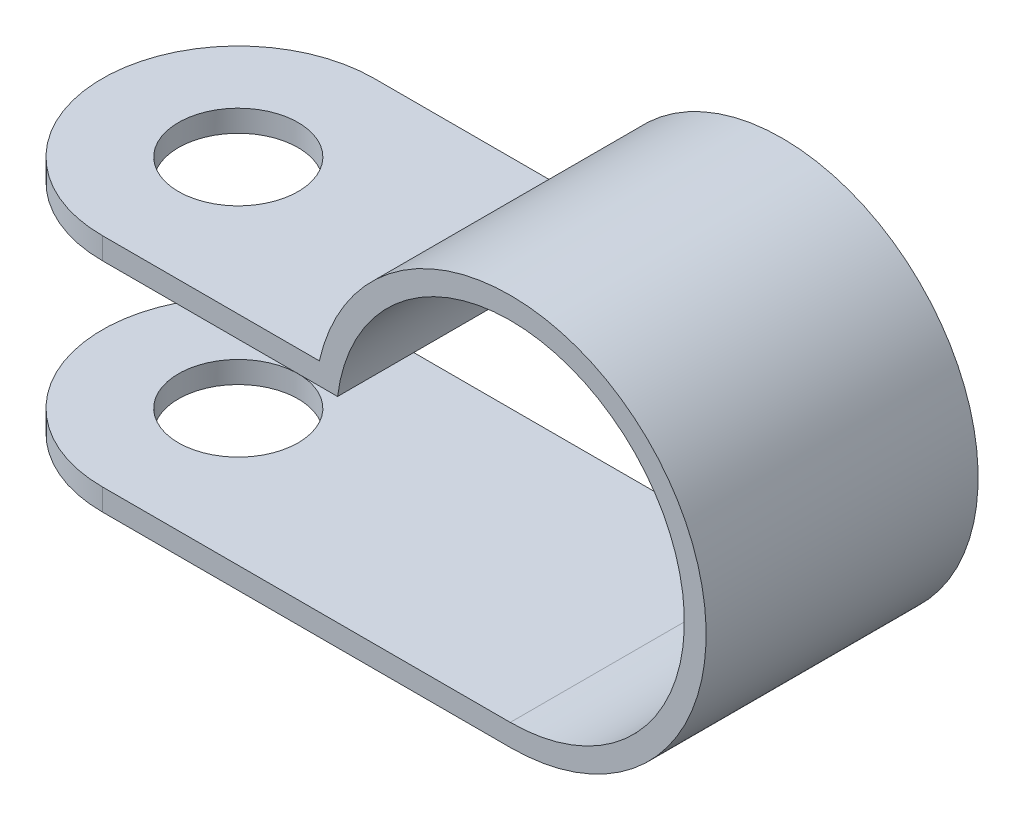
from build123d import *

# Parameters (mm, degrees)
BOSS_EXTRUDE1_DEPTH = 9.525
SKETCH2_R           = 2.0955
CUT_EXTRUDE1_DEPTH  = 29.848015755


with BuildPart() as part:
    # Sketch1 → Boss-Extrude1 (new body)
    with BuildSketch(Plane.XY):
        with BuildLine():
            Line((0, 8.382), (12.363477137, 8.382))
            ThreePointArc((12.363477137, 8.382), (24.411145213, 11.134714393), (19.05, 0))
            Line((19.05, 0), (0, 0))
            Line((0, 0), (0, 0.762))
            Line((0, 0.762), (19.05, 0.762))
            ThreePointArc((19.05, 0.762), (23.622, 10.890124998), (13.001812503, 7.62))
            Line((13.001812503, 7.62), (0, 7.62))
            Line((0, 7.62), (0, 8.382))
        make_face()
    extrude(amount=BOSS_EXTRUDE1_DEPTH)

    # Sketch2 → Cut-Extrude1 (cut, through all)
    with BuildSketch(Plane(origin=(0, 8.382, 0), x_dir=(1, 0, 0), z_dir=(0, 1, 0))):
        with BuildLine():
            Line((0, 0), (0, -4.7625))
            ThreePointArc((0, -4.7625), (1.394903955, -1.394903955), (4.7625, 0))
            Line((4.7625, 0), (0, 0))
        make_face()
        with BuildLine():
            Line((0, -9.525), (4.7625, -9.525))
            ThreePointArc((4.7625, -9.525), (1.394903955, -8.130096045), (0, -4.7625))
            Line((0, -4.7625), (0, -9.525))
        make_face()
        with Locations((4.7625, -4.7625)):
            Circle(SKETCH2_R)
    extrude(amount=-CUT_EXTRUDE1_DEPTH, mode=Mode.SUBTRACT)


solid = part.part
